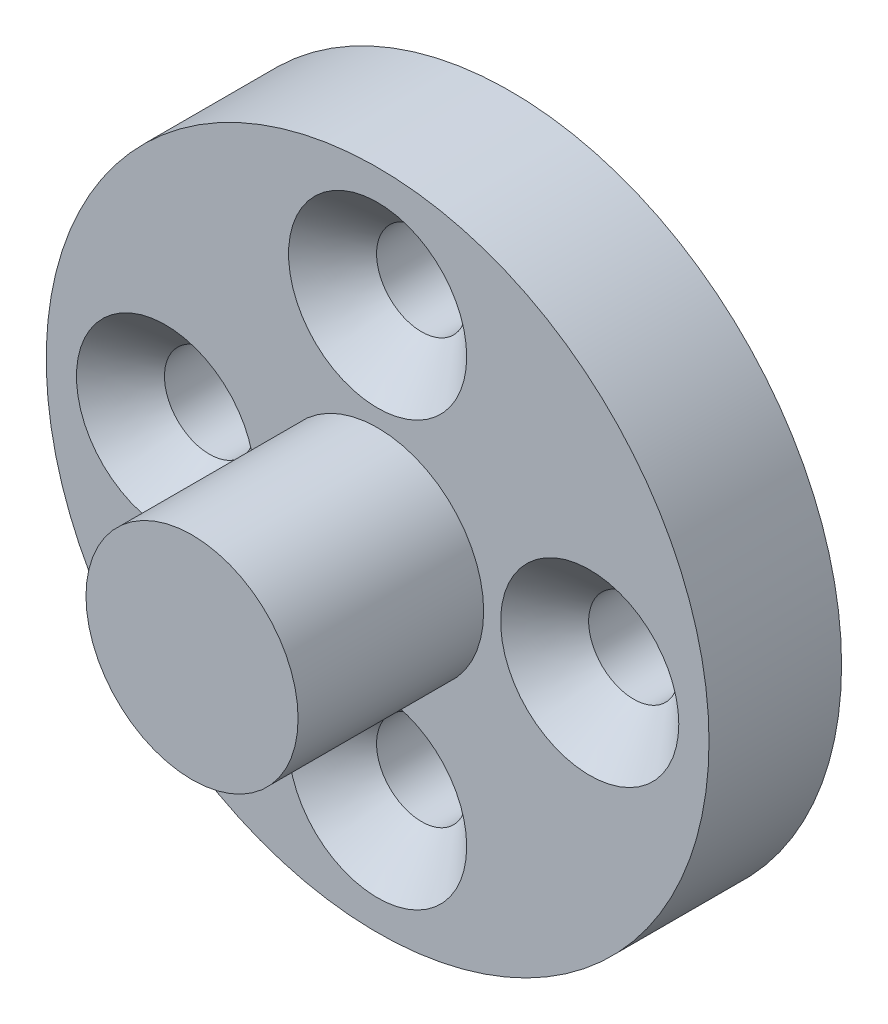
from build123d import *

# Parameters (mm, degrees)
ESBO_O2_R                                           = 12.5
RESSALTO_EXTRUS_O1_DEPTH                            = 5
ESBO_O3_R                                           = 4
RESSALTO_EXTRUS_O2_DEPTH                            = 7
ESCAREADO_PARA_PARAFUSO_ALLEN_SEXTAVADO_D           = 3.4
ESCAREADO_PARA_PARAFUSO_ALLEN_SEXTAVADO_CSINK_D     = 6.72
ESCAREADO_PARA_PARAFUSO_ALLEN_SEXTAVADO_CSINK_ANGLE = 90


with BuildPart() as part:
    # Esboço2 → Ressalto-extrusão1 (new body)
    with BuildSketch(Plane.XY):
        Circle(ESBO_O2_R)
    extrude(amount=RESSALTO_EXTRUS_O1_DEPTH)

    # Esboço3 → Ressalto-extrusão2 (add)
    with BuildSketch(Plane.XY.offset(5)):
        Circle(ESBO_O3_R)
    extrude(amount=RESSALTO_EXTRUS_O2_DEPTH)

    # Escareado para parafuso Allen sextavado escareado de M31 (through all)
    with Locations(Plane.XY.offset(5)):
        with Locations((0, 8), (8, 0), (0, -8), (-8, 0)):
            CounterSinkHole(ESCAREADO_PARA_PARAFUSO_ALLEN_SEXTAVADO_D / 2, ESCAREADO_PARA_PARAFUSO_ALLEN_SEXTAVADO_CSINK_D / 2, counter_sink_angle=ESCAREADO_PARA_PARAFUSO_ALLEN_SEXTAVADO_CSINK_ANGLE)


solid = part.part
